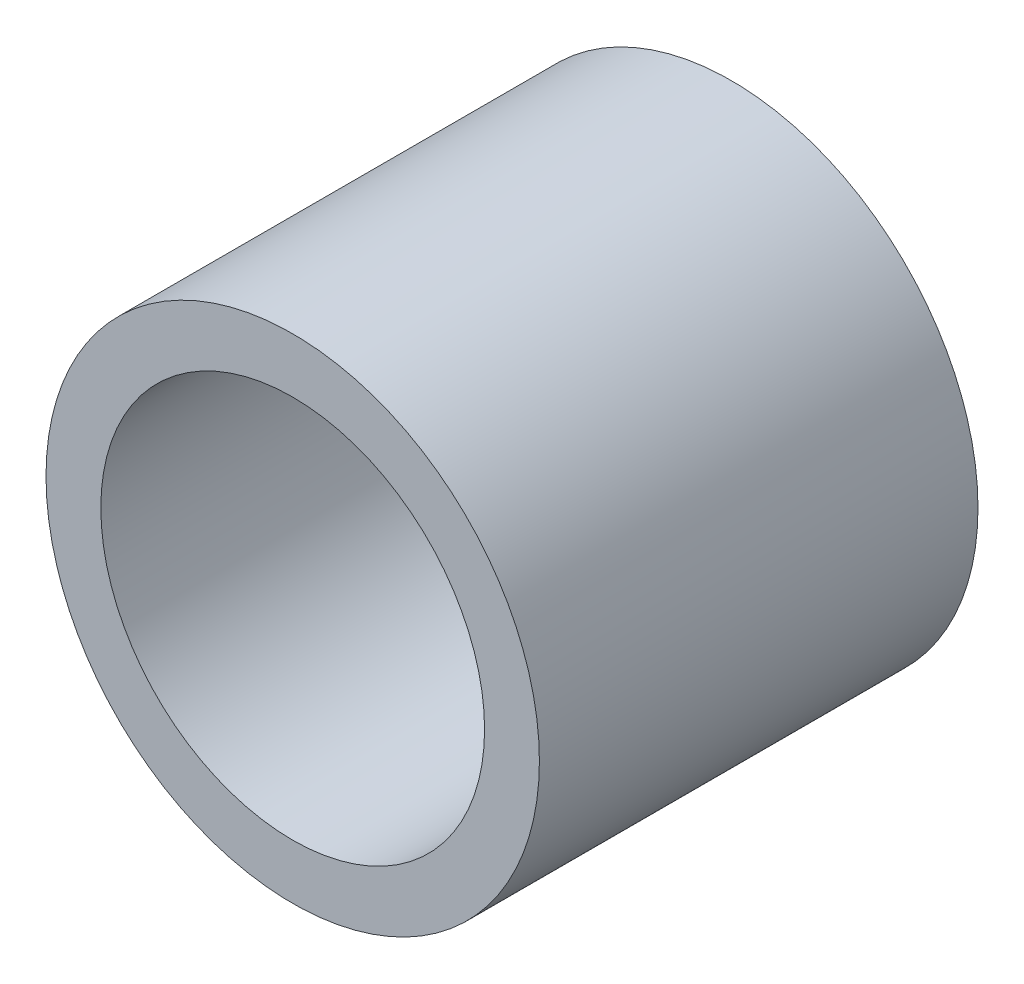
from build123d import *

# Parameters (mm, degrees)
SKETCH1_R           = 28.575
SKETCH1_R_2         = 22.225
BOSS_EXTRUDE1_DEPTH = 50.8


with BuildPart() as part:
    # Sketch1 → Boss-Extrude1 (new body)
    with BuildSketch(Plane.XY):
        with Locations(Location((0, 0, 0), (0, 0, 180))):
            Circle(SKETCH1_R)
        with Locations(Location((0, 0, 0), (0, 0, 180))):
            Circle(SKETCH1_R_2, mode=Mode.SUBTRACT)
    extrude(amount=BOSS_EXTRUDE1_DEPTH)


solid = part.part
